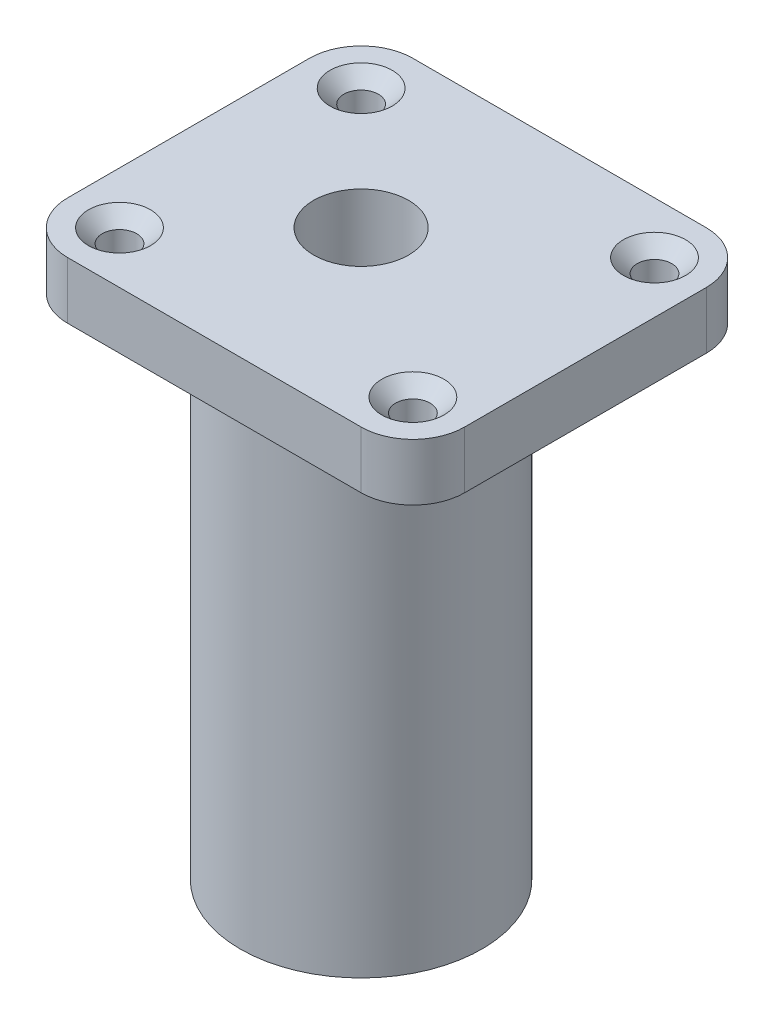
from build123d import *

# Parameters (mm, degrees)
SKETCH1_R           = 7
BOSS_EXTRUDE1_DEPTH = 32.7
SKETCH4_W           = 23
SKETCH4_H           = 20
SKETCH4_R           = 3.5
BOSS_EXTRUDE2_DEPTH = 3.3
FILLET1_R           = 3
SKETCH5_R           = 1
CUT_EXTRUDE3_DEPTH  = 5
SKETCH2_R           = 4.6
CUT_EXTRUDE4_DEPTH  = 5
SKETCH6_R           = 2.75
CUT_EXTRUDE5_DEPTH  = 36
FILLET2_R           = 1
CHAMFER1_SIZE       = 0.8


with BuildPart() as part:
    # Sketch1 → Boss-Extrude1 (new body)
    with BuildSketch(Plane(origin=(0, 0, 0), x_dir=(1, 0, 0), z_dir=(0, 1, 0))):
        with Locations(Location((0, 0, 0), (0, 0, 270))):
            Circle(SKETCH1_R)
    extrude(amount=BOSS_EXTRUDE1_DEPTH)

    # Sketch4 → Boss-Extrude2 (add)
    with BuildSketch(Plane(origin=(0, 32.7, 0), x_dir=(1, 0, 0), z_dir=(0, 1, 0))):
        with Locations((1.5, 0)):
            Rectangle(SKETCH4_W, SKETCH4_H)
        Circle(SKETCH4_R, mode=Mode.SUBTRACT)
    extrude(amount=-BOSS_EXTRUDE2_DEPTH)

    # Fillet1
    fillet1_edges = [part.edges().sort_by_distance(p)[0] for p in [
        (-10, 31.05, 10),
        (-10, 31.05, -10),
        (13, 31.05, -10),
        (13, 31.05, 10),
    ]]
    fillet(fillet1_edges, radius=FILLET1_R)

    # Sketch5 → Cut-Extrude3 (cut)
    with BuildSketch(Plane(origin=(0, 32.7, 0), x_dir=(1, 0, 0), z_dir=(0, 1, 0))):
        with Locations(Location((-7, 7, 0), (0, 0, 270))):
            Circle(SKETCH5_R)
        with Locations(Location((10, 7, 0), (0, 0, 270))):
            Circle(SKETCH5_R)
        with Locations(Location((10, -7, 0), (0, 0, 270))):
            Circle(SKETCH5_R)
        with Locations(Location((-7, -7, 0), (0, 0, 270))):
            Circle(SKETCH5_R)
    extrude(amount=-CUT_EXTRUDE3_DEPTH, mode=Mode.SUBTRACT)

    # Sketch2 → Cut-Extrude4 (cut)
    with BuildSketch(Plane.XZ):
        with Locations(Location((0, 0, 0), (0, 0, 270))):
            Circle(SKETCH2_R)
    extrude(amount=-CUT_EXTRUDE4_DEPTH, mode=Mode.SUBTRACT)

    # Sketch6 → Cut-Extrude5 (cut)
    with BuildSketch(Plane.XZ.offset(-5)):
        with Locations(Location((0, 0, 0), (0, 0, 270))):
            Circle(SKETCH6_R)
    extrude(amount=-CUT_EXTRUDE5_DEPTH, mode=Mode.SUBTRACT)

    # Fillet2
    fillet2_edges = [part.edges().sort_by_distance(p)[0] for p in [
        (0, 29.4, -7),
    ]]
    fillet(fillet2_edges, radius=FILLET2_R)

    # Chamfer1
    chamfer1_edges = [part.edges().sort_by_distance(p)[0] for p in [
        (-7, 32.7, 6),
        (10, 32.7, 6),
        (10, 32.7, -8),
        (-7, 32.7, -8),
    ]]
    chamfer(chamfer1_edges, length=CHAMFER1_SIZE)


solid = part.part
